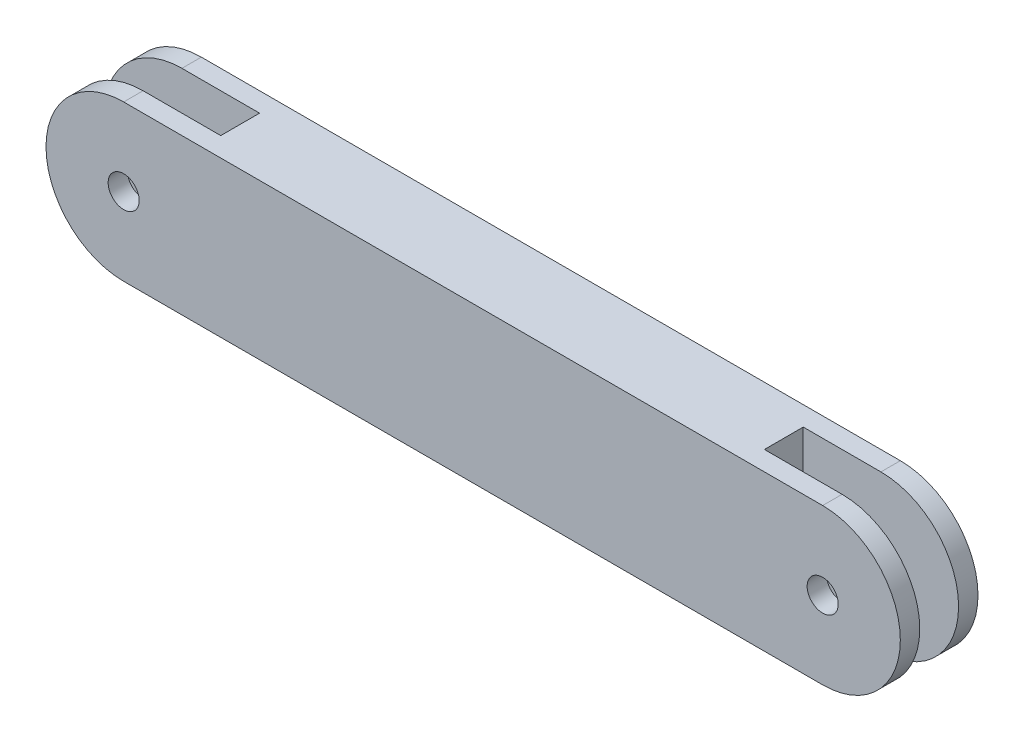
from build123d import *

# Parameters (mm, degrees)
ESQUISSE1_R             = 4
BOSS_EXTRU_1_DEPTH      = 20
ESQUISSE2_W             = 10
ESQUISSE2_H             = 40
ENL_V_MAT_EXTRU_1_DEPTH = 20


with BuildPart() as part:
    # Esquisse1 → Boss.-Extru.1 (new body)
    with BuildSketch(Plane.XY):
        with BuildLine():
            Line((0, 20), (180, 20))
            ThreePointArc((180, 20), (200, 0), (180, -20))
            Line((180, -20), (0, -20))
            ThreePointArc((0, -20), (-20, 0), (0, 20))
        make_face()
        Circle(ESQUISSE1_R, mode=Mode.SUBTRACT)
        with Locations((180, 0)):
            Circle(ESQUISSE1_R, mode=Mode.SUBTRACT)
    extrude(amount=BOSS_EXTRU_1_DEPTH)

    # Esquisse2 → Enlèv. mat.-Extru.1 (cut, symmetric)
    with BuildSketch(Plane(origin=(0, 0, 0), x_dir=(0, 0, -1), z_dir=(1, 0, 0))):
        with Locations((-10, 0)):
            Rectangle(ESQUISSE2_W, ESQUISSE2_H)
    enl_v_mat_extru_1 = extrude(amount=ENL_V_MAT_EXTRU_1_DEPTH, both=True, mode=Mode.SUBTRACT)

    # Symétrie1: Enlèv. mat.-Extru.1 across plane
    add(enl_v_mat_extru_1.mirror(Plane(origin=(90, 0, 0), x_dir=(0, 0, 1), z_dir=(1, 0, 0))), mode=Mode.SUBTRACT)


solid = part.part
